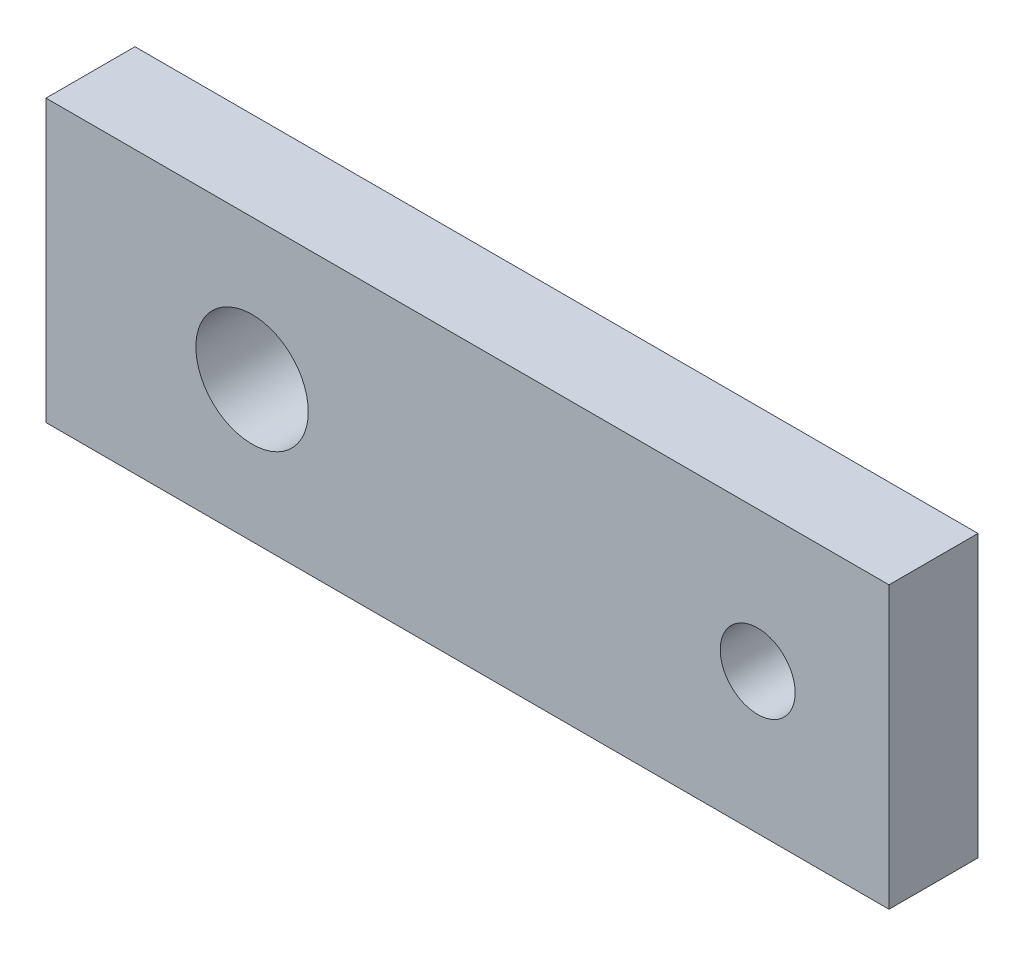
from build123d import *

# Parameters (mm, degrees)
SKETCH1_W           = 90
SKETCH1_H           = 30
SKETCH1_R           = 6
SKETCH1_R_2         = 4
BOSS_EXTRUDE1_DEPTH = 9.5
SKETCH2_R           = 2.5
CUT_EXTRUDE1_DEPTH  = 15


with BuildPart() as part:
    # Sketch1 → Boss-Extrude1 (new body)
    with BuildSketch(Plane.XY):
        Rectangle(SKETCH1_W, SKETCH1_H)
        with Locations((-23, 0)):
            Circle(SKETCH1_R, mode=Mode.SUBTRACT)
        with Locations((30.98, 0)):
            Circle(SKETCH1_R_2, mode=Mode.SUBTRACT)
    extrude(amount=BOSS_EXTRUDE1_DEPTH)

    # Sketch2 → Cut-Extrude1 (cut)
    with BuildSketch(Plane.XZ.offset(15)):
        with Locations(Location((7, 5, 0), (0, 0, 270))):
            Circle(SKETCH2_R)
        with Locations(Location((-37, 5, 0), (0, 0, 270))):
            Circle(SKETCH2_R)
    extrude(amount=-CUT_EXTRUDE1_DEPTH, mode=Mode.SUBTRACT)


solid = part.part
